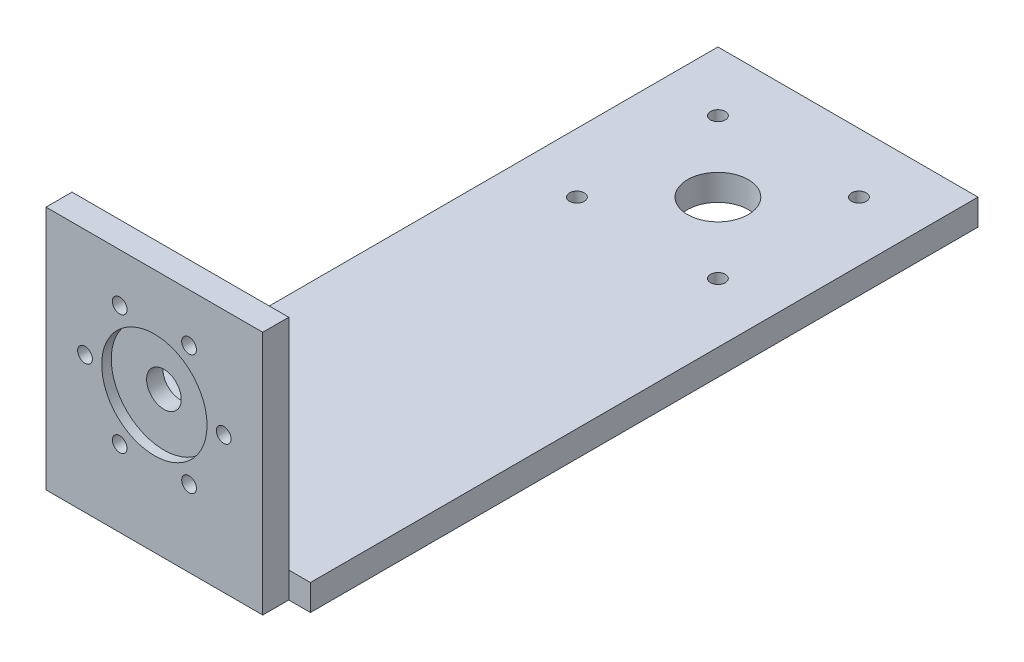
from build123d import *

# Parameters (mm, degrees)
SK_YAW_PLATE_W         = 50
SK_YAW_PLATE_H         = 56.5
SK_YAW_PLATE_R         = 1.7
SK_YAW_PLATE_R_2       = 4
YAW_PLATE_DEPTH        = 6
SK_YAW_PILOT_RECESS_R  = 12.15
YAW_PILOT_RECESS_DEPTH = 2.2
SK_ELBOW_PLATE_W       = 60
SK_ELBOW_PLATE_H       = 154
SK_ELBOW_PLATE_R       = 1.7
SK_ELBOW_PLATE_R_2     = 7
ELBOW_PLATE_DEPTH      = 6


with BuildPart() as part:
    # SK_Yaw_Plate → Yaw_Plate (new body)
    with BuildSketch(Plane.XY.offset(-6)):
        with Locations((0, -3.25)):
            Rectangle(SK_YAW_PLATE_W, SK_YAW_PLATE_H)
        with Locations((16, 0)):
            Circle(SK_YAW_PLATE_R, mode=Mode.SUBTRACT)
        with Locations((8, 13.856406461)):
            Circle(SK_YAW_PLATE_R, mode=Mode.SUBTRACT)
        with Locations((-8, 13.856406461)):
            Circle(SK_YAW_PLATE_R, mode=Mode.SUBTRACT)
        with Locations((-16, 0)):
            Circle(SK_YAW_PLATE_R, mode=Mode.SUBTRACT)
        with Locations((-8, -13.856406461)):
            Circle(SK_YAW_PLATE_R, mode=Mode.SUBTRACT)
        with Locations((8, -13.856406461)):
            Circle(SK_YAW_PLATE_R, mode=Mode.SUBTRACT)
        Circle(SK_YAW_PLATE_R_2, mode=Mode.SUBTRACT)
    extrude(amount=YAW_PLATE_DEPTH)

    # SK_Yaw_Pilot_Recess → Yaw_Pilot_Recess (cut)
    with BuildSketch(Plane.XY):
        Circle(SK_YAW_PILOT_RECESS_R)
    extrude(amount=-YAW_PILOT_RECESS_DEPTH, mode=Mode.SUBTRACT)

    # SK_Elbow_Plate → Elbow_Plate (add)
    with BuildSketch(Plane(origin=(0, -31.5, 0), x_dir=(1, 0, 0), z_dir=(0, 1, 0))):
        with Locations((0, 83)):
            Rectangle(SK_ELBOW_PLATE_W, SK_ELBOW_PLATE_H)
        with Locations(Location((16.263455967, 146.263455967, 0), (0, 0, 270))):
            Circle(SK_ELBOW_PLATE_R, mode=Mode.SUBTRACT)
        with Locations(Location((-16.263455967, 146.263455967, 0), (0, 0, 270))):
            Circle(SK_ELBOW_PLATE_R, mode=Mode.SUBTRACT)
        with Locations(Location((-16.263455967, 113.736544033, 0), (0, 0, 270))):
            Circle(SK_ELBOW_PLATE_R, mode=Mode.SUBTRACT)
        with Locations(Location((16.263455967, 113.736544033, 0), (0, 0, 270))):
            Circle(SK_ELBOW_PLATE_R, mode=Mode.SUBTRACT)
        with Locations(Location((0, 130, 0), (0, 0, 270))):
            Circle(SK_ELBOW_PLATE_R_2, mode=Mode.SUBTRACT)
    extrude(amount=ELBOW_PLATE_DEPTH)


solid = part.part
